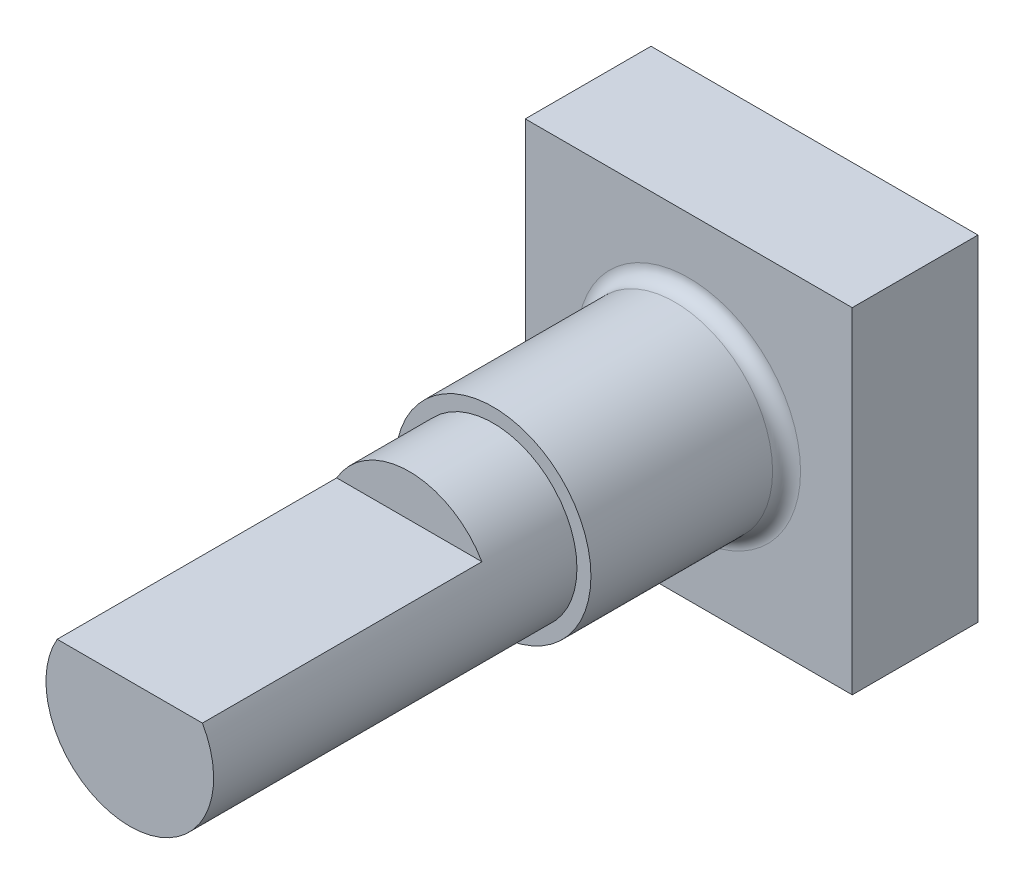
from build123d import *

# Parameters (mm, degrees)
SKETCH_1_W          = 11.7
SKETCH_1_H          = 12
EXTRUDE_1_DEPTH     = 4.5
SKETCH_2_R          = 3.5
EXTRUDE_2_DEPTH     = 7
SKETCH_3_R          = 3
EXTRUDE_3_DEPTH     = 13
CUT_EXTRUDE_START   = -10
CUT_EXTRUDE_1_DEPTH = 10
FILLET_1_R          = 0.5


with BuildPart() as part:
    # 草图1 → 凸台-拉伸1 (new body)
    with BuildSketch(Plane.XY):
        with Locations((5.85, 6)):
            Rectangle(SKETCH_1_W, SKETCH_1_H)
    extrude(amount=EXTRUDE_1_DEPTH)

    # 草图2 → 凸台-拉伸2 (add)
    with BuildSketch(Plane.XY.offset(4.5)):
        with Locations((5.85, 6)):
            Circle(SKETCH_2_R)
    extrude(amount=EXTRUDE_2_DEPTH)

    # 草图3 → 凸台-拉伸3 (add)
    with BuildSketch(Plane.XY.offset(11.5)):
        with Locations(Location((5.85, 6, 0), (0, 0, 180))):
            Circle(SKETCH_3_R)
    extrude(amount=EXTRUDE_3_DEPTH)

    # 草图4 → 切除-拉伸1 (cut)
    with BuildSketch(Plane.XY.offset(24.5).offset(CUT_EXTRUDE_START)):
        with BuildLine():
            Line((3.251923789, 7.5), (8.448076211, 7.5))
            ThreePointArc((8.448076211, 7.5), (5.85, 9), (3.251923789, 7.5))
        make_face()
    extrude(amount=CUT_EXTRUDE_1_DEPTH, mode=Mode.SUBTRACT)

    # 圆角1
    fillet_1_edges = [part.edges().sort_by_distance(p)[0] for p in [
        (2.35, 6, 4.5),
    ]]
    fillet(fillet_1_edges, radius=FILLET_1_R)


solid = part.part
